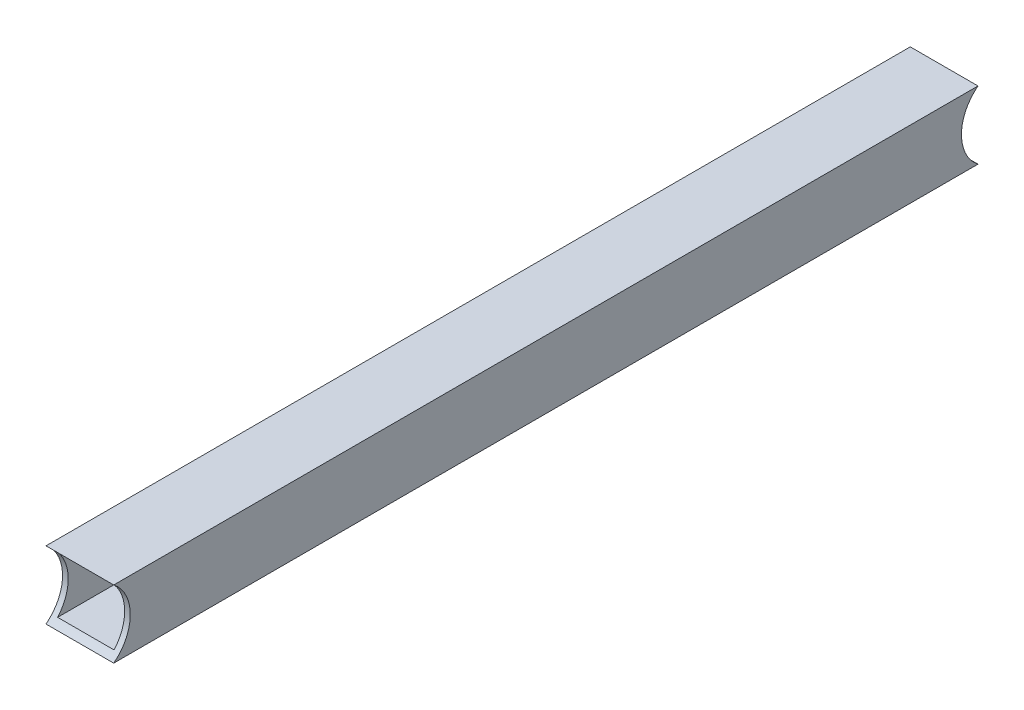
from build123d import *

# Parameters (mm, degrees)
BOSS_EXTRUDE1_DEPTH = 38.1
SKETCH2_W           = 31.75
SKETCH2_H           = 31.75
CUT_EXTRUDE1_DEPTH  = 504.835943665


with BuildPart() as part:
    # Sketch1 → Boss-Extrude1 (new body)
    with BuildSketch(Plane(origin=(0, 0, 0), x_dir=(0, 0, -1), z_dir=(1, 0, 0))):
        with BuildLine():
            ThreePointArc((24.13, 19.05), (21.675298243, 8.446305074), (14.810617813, 0))
            Line((14.810617813, 0), (500.946542187, 0))
            ThreePointArc((500.946542187, 0), (491.62716, 19.05), (500.946542187, 38.1))
            Line((500.946542187, 38.1), (14.810617813, 38.1))
            ThreePointArc((14.810617813, 38.1), (21.675298243, 29.653694926), (24.13, 19.05))
        make_face()
    extrude(amount=BOSS_EXTRUDE1_DEPTH)

    # Sketch2 → Cut-Extrude1 (cut, through all)
    with BuildSketch(Plane.XY):
        with Locations((19.05, 19.05)):
            Rectangle(SKETCH2_W, SKETCH2_H)
    extrude(amount=-CUT_EXTRUDE1_DEPTH, mode=Mode.SUBTRACT)


solid = part.part
